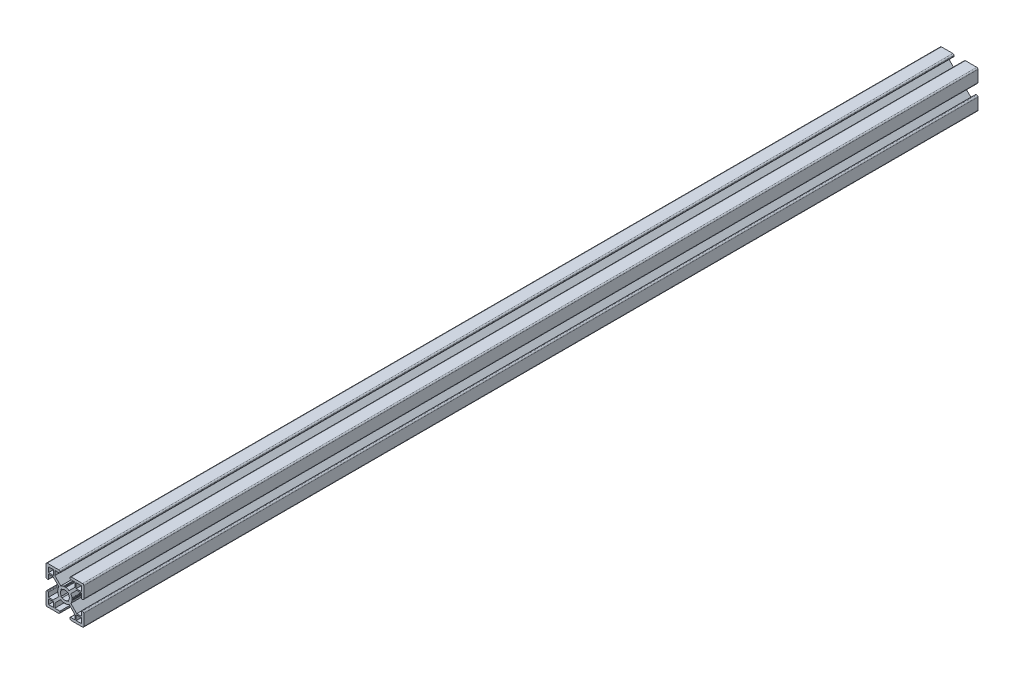
from build123d import *

# Parameters (mm, degrees)
SKETCH1_W           = 4
SKETCH1_H           = 4
BOSS_EXTRUDE1_DEPTH = 355


with BuildPart() as part:
    # Sketch1 → Boss-Extrude1 (new, symmetric)
    with BuildSketch(Plane.XY):
        with BuildLine():
            Line((-15, 14), (-15, 5))
            ThreePointArc((-15, 5), (-14.707106781, 4.292893219), (-14, 4))
            Line((-14, 4), (-13.5, 4))
            ThreePointArc((-13.5, 4), (-13.146446609, 4.146446609), (-13, 4.5))
            Line((-13, 4.5), (-13, 8))
            Line((-13, 8), (-9.414213562, 8))
            Line((-9.414213562, 8), (-4.711011126, 3.296797563))
            ThreePointArc((-4.711011126, 3.296797563), (-5.322383956, 2.17594325), (-5.671345569, 0.947807702))
            ThreePointArc((-5.671345569, 0.947807702), (-5.502585747, 0.723913043), (-5.723511591, 0.551284925))
            ThreePointArc((-5.723511591, 0.551284925), (-5.737706139, 0.375803491), (-5.746521739, 0.199969752))
            ThreePointArc((-5.746521739, 0.199969752), (-5.607354194, 0.140186212), (-5.55, 0))
            ThreePointArc((-5.55, 0), (-5.607354194, -0.140186212), (-5.746521739, -0.199969752))
            ThreePointArc((-5.746521739, -0.199969752), (-5.737706139, -0.375803491), (-5.723511591, -0.551284925))
            ThreePointArc((-5.723511591, -0.551284925), (-5.502585747, -0.723913043), (-5.671345569, -0.947807702))
            ThreePointArc((-5.671345569, -0.947807702), (-5.322383956, -2.17594325), (-4.711011126, -3.296797563))
            Line((-4.711011126, -3.296797563), (-9.414213562, -8))
            Line((-9.414213562, -8), (-13, -8))
            Line((-13, -8), (-13, -4.5))
            ThreePointArc((-13, -4.5), (-13.146446609, -4.146446609), (-13.5, -4))
            Line((-13.5, -4), (-14, -4))
            ThreePointArc((-14, -4), (-14.707106781, -4.292893219), (-15, -5))
            Line((-15, -5), (-15, -14))
            ThreePointArc((-15, -14), (-14.707106781, -14.707106781), (-14, -15))
            Line((-14, -15), (-5, -15))
            ThreePointArc((-5, -15), (-4.292893219, -14.707106781), (-4, -14))
            Line((-4, -14), (-4, -13))
            Line((-4, -13), (-8, -13))
            Line((-8, -13), (-8, -9.414213562))
            Line((-8, -9.414213562), (-3.296797563, -4.711011126))
            ThreePointArc((-3.296797563, -4.711011126), (-2.17594325, -5.322383956), (-0.947807702, -5.671345569))
            ThreePointArc((-0.947807702, -5.671345569), (-0.723913043, -5.502585747), (-0.551284925, -5.723511591))
            ThreePointArc((-0.551284925, -5.723511591), (-0.375803491, -5.737706139), (-0.199969752, -5.746521739))
            ThreePointArc((-0.199969752, -5.746521739), (-0.140186212, -5.607354194), (0, -5.55))
            ThreePointArc((0, -5.55), (0.140186212, -5.607354194), (0.199969752, -5.746521739))
            ThreePointArc((0.199969752, -5.746521739), (0.375803491, -5.737706139), (0.551284925, -5.723511591))
            ThreePointArc((0.551284925, -5.723511591), (0.723913043, -5.502585747), (0.947807702, -5.671345569))
            ThreePointArc((0.947807702, -5.671345569), (2.17594325, -5.322383956), (3.296797563, -4.711011126))
            Line((3.296797563, -4.711011126), (8, -9.414213562))
            Line((8, -9.414213562), (8, -13))
            Line((8, -13), (4.5, -13))
            ThreePointArc((4.5, -13), (4.146446609, -13.146446609), (4, -13.5))
            Line((4, -13.5), (4, -14))
            ThreePointArc((4, -14), (4.292893219, -14.707106781), (5, -15))
            Line((5, -15), (14, -15))
            ThreePointArc((14, -15), (14.707106781, -14.707106781), (15, -14))
            Line((15, -14), (15, -5))
            ThreePointArc((15, -5), (14.707106781, -4.292893219), (14, -4))
            Line((14, -4), (13.5, -4))
            ThreePointArc((13.5, -4), (13.146446609, -4.146446609), (13, -4.5))
            Line((13, -4.5), (13, -8))
            Line((13, -8), (9.414213562, -8))
            Line((9.414213562, -8), (4.711011126, -3.296797563))
            ThreePointArc((4.711011126, -3.296797563), (5.322383956, -2.17594325), (5.671345569, -0.947807702))
            ThreePointArc((5.671345569, -0.947807702), (5.502585747, -0.723913043), (5.723511591, -0.551284925))
            ThreePointArc((5.723511591, -0.551284925), (5.737706139, -0.375803491), (5.746521739, -0.199969752))
            ThreePointArc((5.746521739, -0.199969752), (5.607354194, -0.140186212), (5.55, 0))
            ThreePointArc((5.55, 0), (5.607354194, 0.140186212), (5.746521739, 0.199969752))
            ThreePointArc((5.746521739, 0.199969752), (5.737706139, 0.375803491), (5.723511591, 0.551284925))
            ThreePointArc((5.723511591, 0.551284925), (5.502585747, 0.723913043), (5.671345569, 0.947807702))
            ThreePointArc((5.671345569, 0.947807702), (5.322383956, 2.17594325), (4.711011126, 3.296797563))
            Line((4.711011126, 3.296797563), (9.414213562, 8))
            Line((9.414213562, 8), (13, 8))
            Line((13, 8), (13, 4.5))
            ThreePointArc((13, 4.5), (13.146446609, 4.146446609), (13.5, 4))
            Line((13.5, 4), (14, 4))
            ThreePointArc((14, 4), (14.707106781, 4.292893219), (15, 5))
            Line((15, 5), (15, 14))
            ThreePointArc((15, 14), (14.707106781, 14.707106781), (14, 15))
            Line((14, 15), (5, 15))
            ThreePointArc((5, 15), (4.292893219, 14.707106781), (4, 14))
            Line((4, 14), (4, 13.5))
            ThreePointArc((4, 13.5), (4.146446609, 13.146446609), (4.5, 13))
            Line((4.5, 13), (8, 13))
            Line((8, 13), (8, 9.414213562))
            Line((8, 9.414213562), (3.296797563, 4.711011126))
            ThreePointArc((3.296797563, 4.711011126), (2.17594325, 5.322383956), (0.947807702, 5.671345569))
            ThreePointArc((0.947807702, 5.671345569), (0.723913043, 5.502585747), (0.551284925, 5.723511591))
            ThreePointArc((0.551284925, 5.723511591), (0.375803491, 5.737706139), (0.199969752, 5.746521739))
            ThreePointArc((0.199969752, 5.746521739), (0.140186212, 5.607354194), (0, 5.55))
            ThreePointArc((0, 5.55), (-0.140186212, 5.607354194), (-0.199969752, 5.746521739))
            ThreePointArc((-0.199969752, 5.746521739), (-0.375803491, 5.737706139), (-0.551284925, 5.723511591))
            ThreePointArc((-0.551284925, 5.723511591), (-0.723913043, 5.502585747), (-0.947807702, 5.671345569))
            ThreePointArc((-0.947807702, 5.671345569), (-2.17594325, 5.322383956), (-3.296797563, 4.711011126))
            Line((-3.296797563, 4.711011126), (-8, 9.414213562))
            Line((-8, 9.414213562), (-8, 13))
            Line((-8, 13), (-4.5, 13))
            ThreePointArc((-4.5, 13), (-4.146446609, 13.146446609), (-4, 13.5))
            Line((-4, 13.5), (-4, 14))
            ThreePointArc((-4, 14), (-4.292893219, 14.707106781), (-5, 15))
            Line((-5, 15), (-14, 15))
            ThreePointArc((-14, 15), (-14.707106781, 14.707106781), (-15, 14))
        make_face()
        with Locations((-11, -11)):
            Rectangle(SKETCH1_W, SKETCH1_H, mode=Mode.SUBTRACT)
        with Locations((11, -11)):
            Rectangle(SKETCH1_W, SKETCH1_H, mode=Mode.SUBTRACT)
        with BuildLine():
            ThreePointArc((-2.096969605, 2.802270236), (-1.105000944, 3.320989749), (0, 3.5))
            ThreePointArc((0, 3.5), (1.105000944, 3.320989749), (2.096969605, 2.802270236))
            ThreePointArc((2.096969605, 2.802270236), (2.828427125, 2.828427125), (2.802270236, 2.096969605))
            ThreePointArc((2.802270236, 2.096969605), (3.320989749, 1.105000944), (3.5, 0))
            ThreePointArc((3.5, 0), (3.320989749, -1.105000944), (2.802270236, -2.096969605))
            ThreePointArc((2.802270236, -2.096969605), (2.828427125, -2.828427125), (2.096969605, -2.802270236))
            ThreePointArc((2.096969605, -2.802270236), (1.105000944, -3.320989749), (0, -3.5))
            ThreePointArc((0, -3.5), (-1.105000944, -3.320989749), (-2.096969605, -2.802270236))
            ThreePointArc((-2.096969605, -2.802270236), (-2.828427125, -2.828427125), (-2.802270236, -2.096969605))
            ThreePointArc((-2.802270236, -2.096969605), (-3.320989749, -1.105000944), (-3.5, 0))
            ThreePointArc((-3.5, 0), (-3.320989749, 1.105000944), (-2.802270236, 2.096969605))
            ThreePointArc((-2.802270236, 2.096969605), (-2.828427125, 2.828427125), (-2.096969605, 2.802270236))
        make_face(mode=Mode.SUBTRACT)
        with Locations((-11, 11)):
            Rectangle(SKETCH1_W, SKETCH1_H, mode=Mode.SUBTRACT)
        with Locations((11, 11)):
            Rectangle(SKETCH1_W, SKETCH1_H, mode=Mode.SUBTRACT)
    extrude(amount=BOSS_EXTRUDE1_DEPTH, both=True)


solid = part.part
